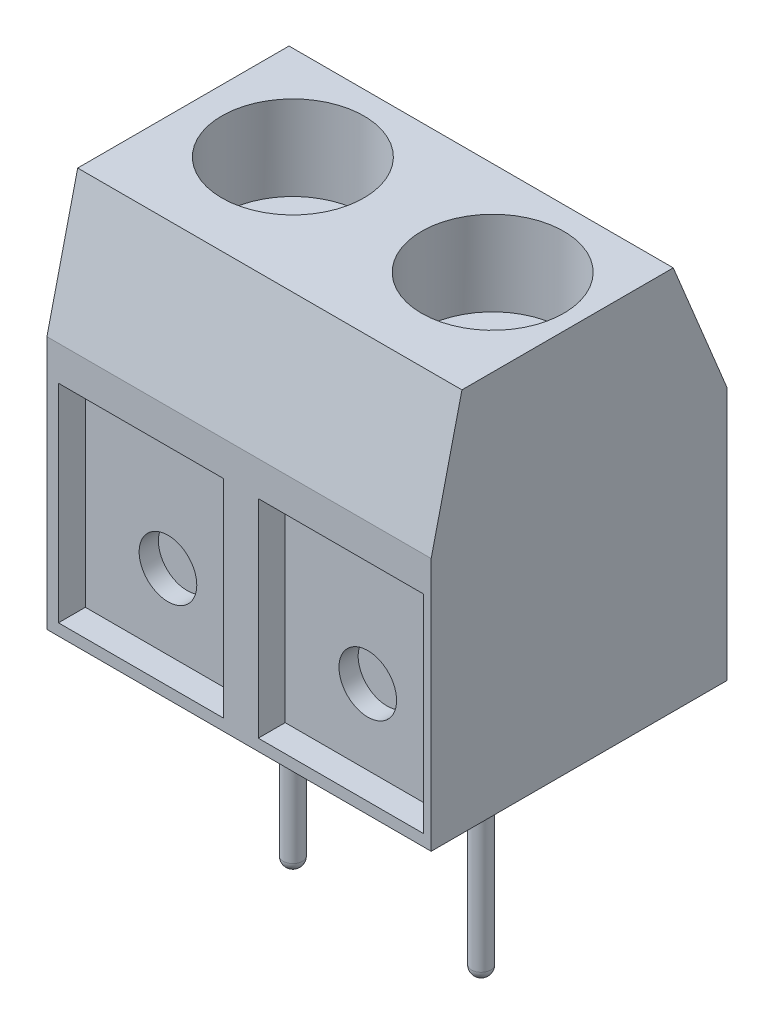
from build123d import *

# Parameters (mm, degrees)
CROQUIS1_W                          = 10
CROQUIS1_H                          = 7.7
SALIENTE_EXTRUIR1_DEPTH             = 6.6
SALIENTE_EXTRUIR2_REACH             = 11.131
SALIENTE_EXTRUIR2_DIRECTION_2_REACH = 11.131
CROQUIS3_R                          = 1.85
CORTAR_EXTRUIR1_DEPTH               = 2.2
CORTAR_EXTRUIR2_DEPTH               = 0.25
MATRIZL1_COUNT                      = 2
MATRIZL1_PITCH                      = 5.2
CROQUIS5_W                          = 4.3
CROQUIS5_H                          = 5.4
CROQUIS5_R                          = 0.75
CORTAR_EXTRUIR3_DEPTH               = 0.7
CROQUIS5_2_R                        = 0.75
CORTAR_EXTRUIR4_DEPTH               = 1.2
MATRIZL2_COUNT                      = 2
MATRIZL2_PITCH                      = 5.2
CROQUIS6_R                          = 0.25
SALIENTE_EXTRUIR3_DEPTH             = 6
REDONDEO1_R                         = 0.25


with BuildPart() as part:
    # Croquis1 → Saliente-Extruir1 (new body)
    with BuildSketch(Plane(origin=(0, 0, 0), x_dir=(1, 0, 0), z_dir=(0, 1, 0))):
        Rectangle(CROQUIS1_W, CROQUIS1_H)
    extrude(amount=SALIENTE_EXTRUIR1_DEPTH)

    # Saliente-Extruir2: up to this face of the body (flat: up to its plane)
    saliente_extruir2_end = Plane(part.part.faces().sort_by_distance((5, 3.3, 0))[0])
    # Croquis2 → Saliente-Extruir2 (add, up to the picked face)
    with BuildSketch(Plane(origin=(0, 0, 0), x_dir=(0, 0, -1), z_dir=(1, 0, 0)), mode=Mode.PRIVATE) as saliente_extruir2_sk1:
        Polygon((-3.85, 6.6), (3.85, 6.6), (2.45, 10), (-3.05, 10), align=None)
    saliente_extruir2_tool1 = split(extrude(saliente_extruir2_sk1.sketch, amount=SALIENTE_EXTRUIR2_REACH, mode=Mode.PRIVATE), bisect_by=saliente_extruir2_end, keep=Keep.BOTH, mode=Mode.PRIVATE)
    add(saliente_extruir2_tool1.solids().sort_by(Axis((0, 8.205556, 0.141667), (1, 0, 0)))[0])

    # Saliente-Extruir2 direction 2: up to this face of the body (flat: up to its plane)
    saliente_extruir2_direction_2_end = Plane(part.part.faces().sort_by_distance((-5, 3.3, 0))[0])
    # Croquis2 → Saliente-Extruir2 direction 2 (add, up to the picked face)
    with BuildSketch(Plane(origin=(0, 0, 0), x_dir=(0, 0, -1), z_dir=(1, 0, 0)), mode=Mode.PRIVATE) as saliente_extruir2_direction_2_sk1:
        Polygon((-3.85, 6.6), (3.85, 6.6), (2.45, 10), (-3.05, 10), align=None)
    saliente_extruir2_direction_2_tool1 = split(extrude(saliente_extruir2_direction_2_sk1.sketch, amount=-SALIENTE_EXTRUIR2_DIRECTION_2_REACH, mode=Mode.PRIVATE), bisect_by=saliente_extruir2_direction_2_end, keep=Keep.BOTH, mode=Mode.PRIVATE)
    add(saliente_extruir2_direction_2_tool1.solids().sort_by(Axis((0, 8.205556, 0.141667), (-1, 0, 0)))[0])

    # Croquis3 → Cortar-Extruir1 (cut)
    with BuildSketch(Plane(origin=(0, 10, 0), x_dir=(1, 0, 0), z_dir=(0, 1, 0))):
        with Locations((-2.45, 0)):
            Circle(CROQUIS3_R)
    cortar_extruir1 = extrude(amount=-CORTAR_EXTRUIR1_DEPTH, mode=Mode.SUBTRACT)

    # Croquis4 → Cortar-Extruir2 (cut)
    with BuildSketch(Plane(origin=(0, 7.8, 0), x_dir=(1, 0, 0), z_dir=(0, 1, 0))):
        with BuildLine():
            ThreePointArc((-2.7, -1.833030278), (-2.45, -1.85), (-2.2, -1.833030278))
            Line((-2.2, -1.833030278), (-2.2, -0.25))
            Line((-2.2, -0.25), (-0.616969722, -0.25))
            ThreePointArc((-0.616969722, -0.25), (-0.604247306, -0.125287641), (-0.6, 0))
            ThreePointArc((-0.6, 0), (-0.604247306, 0.125287641), (-0.616969722, 0.25))
            Line((-0.616969722, 0.25), (-2.2, 0.25))
            Line((-2.2, 0.25), (-2.2, 1.833030278))
            ThreePointArc((-2.2, 1.833030278), (-2.45, 1.85), (-2.7, 1.833030278))
            Line((-2.7, 1.833030278), (-2.7, 0.25))
            Line((-2.7, 0.25), (-4.283030278, 0.25))
            ThreePointArc((-4.283030278, 0.25), (-4.3, 0), (-4.283030278, -0.25))
            Line((-4.283030278, -0.25), (-2.7, -0.25))
            Line((-2.7, -0.25), (-2.7, -1.833030278))
        make_face()
    cortar_extruir2 = extrude(amount=-CORTAR_EXTRUIR2_DEPTH, mode=Mode.SUBTRACT)

    # MatrizL1: Cortar-Extruir1, Cortar-Extruir2 ×2
    with Locations(*[(i * MATRIZL1_PITCH, 0, 0) for i in range(1, MATRIZL1_COUNT)]):
        add(cortar_extruir1, mode=Mode.SUBTRACT)
        add(cortar_extruir2, mode=Mode.SUBTRACT)

    # Croquis5 → Cortar-Extruir3 (cut)
    with BuildSketch(Plane.XY.offset(3.85)):
        with Locations((-2.55, 3)):
            Rectangle(CROQUIS5_W, CROQUIS5_H)
        with Locations((-2.55, 2.25)):
            Circle(CROQUIS5_R, mode=Mode.SUBTRACT)
    cortar_extruir3 = extrude(amount=-CORTAR_EXTRUIR3_DEPTH, mode=Mode.SUBTRACT)

    # Croquis5<2> → Cortar-Extruir4 (cut)
    with BuildSketch(Plane.XY.offset(3.85)):
        with Locations((-2.55, 2.25)):
            Circle(CROQUIS5_2_R)
    cortar_extruir4 = extrude(amount=-CORTAR_EXTRUIR4_DEPTH, mode=Mode.SUBTRACT)

    # MatrizL2: Cortar-Extruir3, Cortar-Extruir4 ×2
    with Locations(*[(i * MATRIZL2_PITCH, 0, 0) for i in range(1, MATRIZL2_COUNT)]):
        add(cortar_extruir3, mode=Mode.SUBTRACT)
        add(cortar_extruir4, mode=Mode.SUBTRACT)

    # Croquis6 → Saliente-Extruir3 (add)
    with BuildSketch(Plane.XZ):
        with Locations((-2.45, 0)):
            Circle(CROQUIS6_R)
        with Locations((2.45, 0)):
            Circle(CROQUIS6_R)
    extrude(amount=SALIENTE_EXTRUIR3_DEPTH)

    # Redondeo1
    redondeo1_edges = [part.edges().sort_by_distance(p)[0] for p in [
        (-2.7, -6, 0),
        (2.2, -6, 0),
    ]]
    fillet(redondeo1_edges, radius=REDONDEO1_R)


solid = part.part
